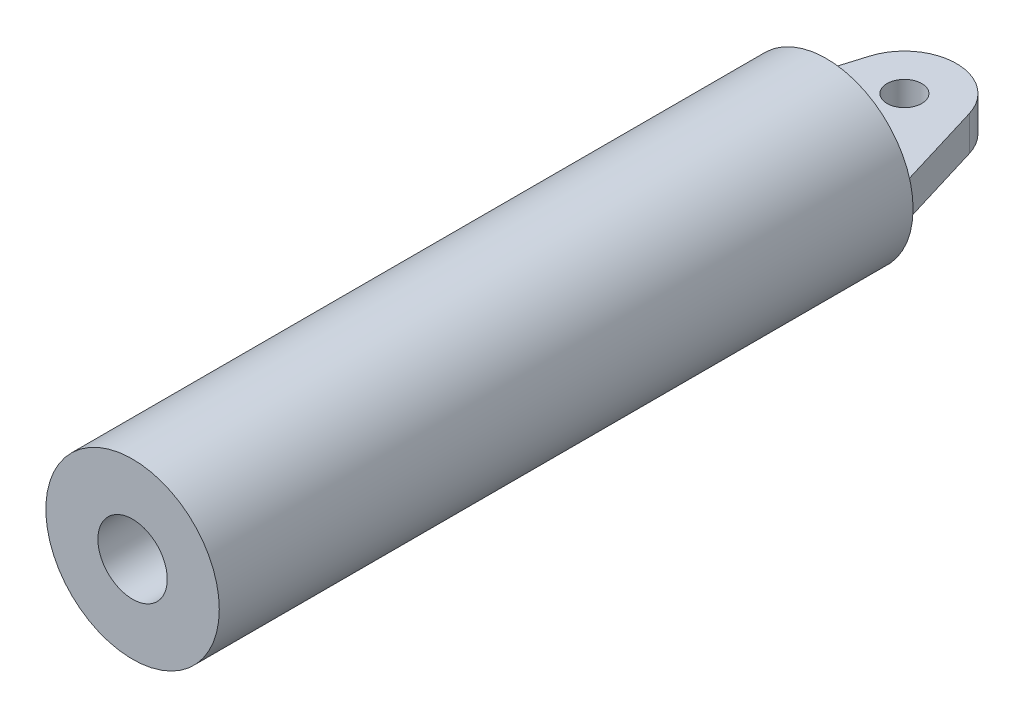
from build123d import *

# Parameters (mm, degrees)
SKETCH1_R           = 50
BOSS_EXTRUDE1_DEPTH = 400
SHELL1_T            = -30
SKETCH2_R           = 10
BOSS_EXTRUDE2_DEPTH = 10


with BuildPart() as part:
    # Sketch1 → Boss-Extrude1 (new body)
    with BuildSketch(Plane.XY):
        Circle(SKETCH1_R)
    extrude(amount=BOSS_EXTRUDE1_DEPTH)

    # Shell1
    shell1_openings = [part.faces().sort_by_distance(p)[0] for p in [
        (0, 0, 400),
    ]]
    offset(amount=SHELL1_T, openings=shell1_openings, kind=Kind.INTERSECTION)

    # Sketch2 → Boss-Extrude2 (add, symmetric)
    with BuildSketch(Plane(origin=(0, 0, 0), x_dir=(1, 0, 0), z_dir=(0, 1, 0))):
        with BuildLine():
            Line((-45, 0), (-28.708286934, 53.708286934))
            ThreePointArc((-28.708286934, 53.708286934), (0, 75), (28.708286934, 53.708286934))
            Line((28.708286934, 53.708286934), (45, 0))
            Line((45, 0), (-45, 0))
        make_face()
        with Locations(Location((0, 45, 0), (0, 0, 270))):
            Circle(SKETCH2_R, mode=Mode.SUBTRACT)
    extrude(amount=BOSS_EXTRUDE2_DEPTH, both=True)


solid = part.part
